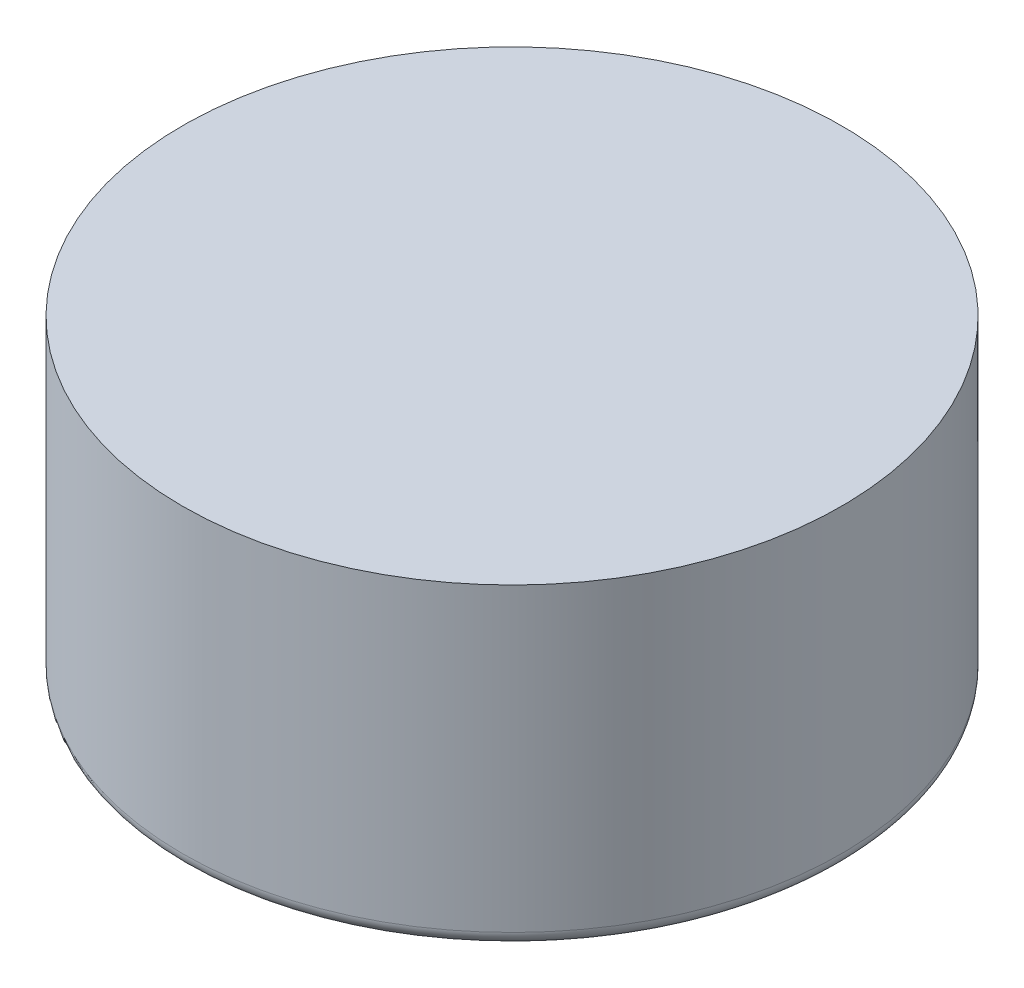
from build123d import *

# Parameters (mm, degrees)
SKETCH1_R           = 11.5
BOSS_EXTRUDE1_DEPTH = 5.5
SKETCH2_R           = 1
BOSS_EXTRUDE2_DEPTH = 3.25
FILLET1_R           = 0.5


with BuildPart() as part:
    # Sketch1 → Boss-Extrude1 (new, symmetric)
    with BuildSketch(Plane(origin=(0, 0, 0), x_dir=(1, 0, 0), z_dir=(0, 1, 0))):
        with Locations(Location((0, 0, 0), (0, 0, 270))):
            Circle(SKETCH1_R)
    extrude(amount=BOSS_EXTRUDE1_DEPTH, both=True)

    # Sketch2 → Boss-Extrude2 (add, symmetric)
    with BuildSketch(Plane.XZ.offset(5.5)):
        with Locations(Location((0, 0, 0), (0, 0, 90))):
            Circle(SKETCH2_R)
    extrude(amount=BOSS_EXTRUDE2_DEPTH, both=True)

    # Fillet1
    fillet1_edges = [part.edges().sort_by_distance(p)[0] for p in [
        (0, -5.5, -11.5),
    ]]
    fillet(fillet1_edges, radius=FILLET1_R)


solid = part.part
